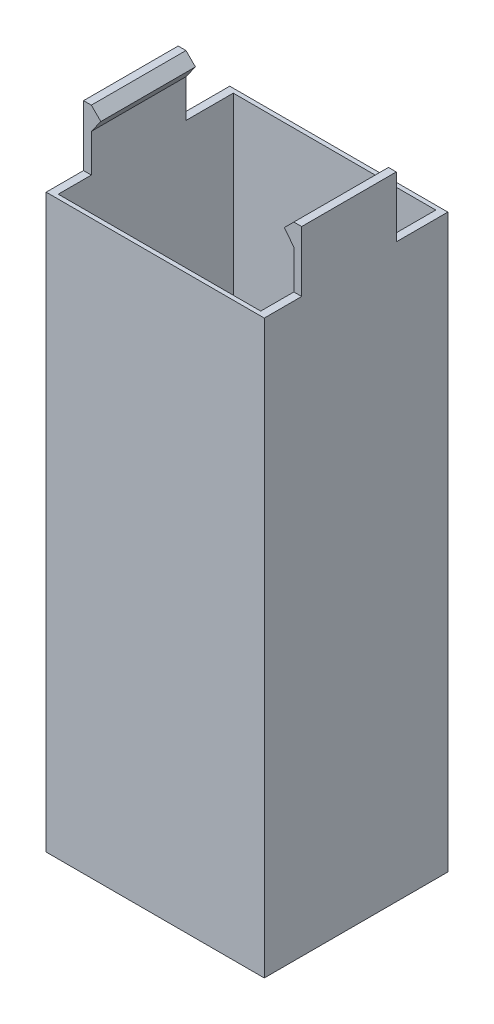
from build123d import *

# Parameters (mm, degrees)
SKETCH1_W           = 46.1
SKETCH1_H           = 38.8
SKETCH1_W_2         = 42.8
SKETCH1_H_2         = 37
BOSS_EXTRUDE1_DEPTH = 120
SKETCH2_W           = 1.65
SKETCH2_H           = 20
BOSS_EXTRUDE2_DEPTH = 12.8
BOSS_EXTRUDE5_DEPTH = 20
SKETCH6_W           = 46.1
SKETCH6_H           = 38.8
BOSS_EXTRUDE6_DEPTH = 0.8


with BuildPart() as part:
    # Sketch1 → Boss-Extrude1 (new body)
    with BuildSketch(Plane(origin=(0, 0, 0), x_dir=(1, 0, 0), z_dir=(0, 1, 0))):
        Rectangle(SKETCH1_W, SKETCH1_H)
        Rectangle(SKETCH1_W_2, SKETCH1_H_2, mode=Mode.SUBTRACT)
    extrude(amount=BOSS_EXTRUDE1_DEPTH)

    # Sketch2 → Boss-Extrude2 (add)
    with BuildSketch(Plane(origin=(0, 120, 0), x_dir=(1, 0, 0), z_dir=(0, 1, 0))):
        with Locations((22.225, -1.5)):
            Rectangle(SKETCH2_W, SKETCH2_H)
        with Locations((-22.225, -1.5)):
            Rectangle(SKETCH2_W, SKETCH2_H)
    extrude(amount=BOSS_EXTRUDE2_DEPTH)

    # Sketch5 → Boss-Extrude5 (add)
    with BuildSketch(Plane.XY.offset(11.5)):
        Polygon((-19.4, 130.8), (-21.4, 128), (-21.4, 132.8), align=None)
        Polygon((21.4, 128.2), (21.4, 132.8), (19.4, 130.8), align=None)
    extrude(amount=-BOSS_EXTRUDE5_DEPTH)

    # Sketch6 → Boss-Extrude6 (add)
    with BuildSketch(Plane.XZ):
        Rectangle(SKETCH6_W, SKETCH6_H)
    extrude(amount=BOSS_EXTRUDE6_DEPTH)


solid = part.part
